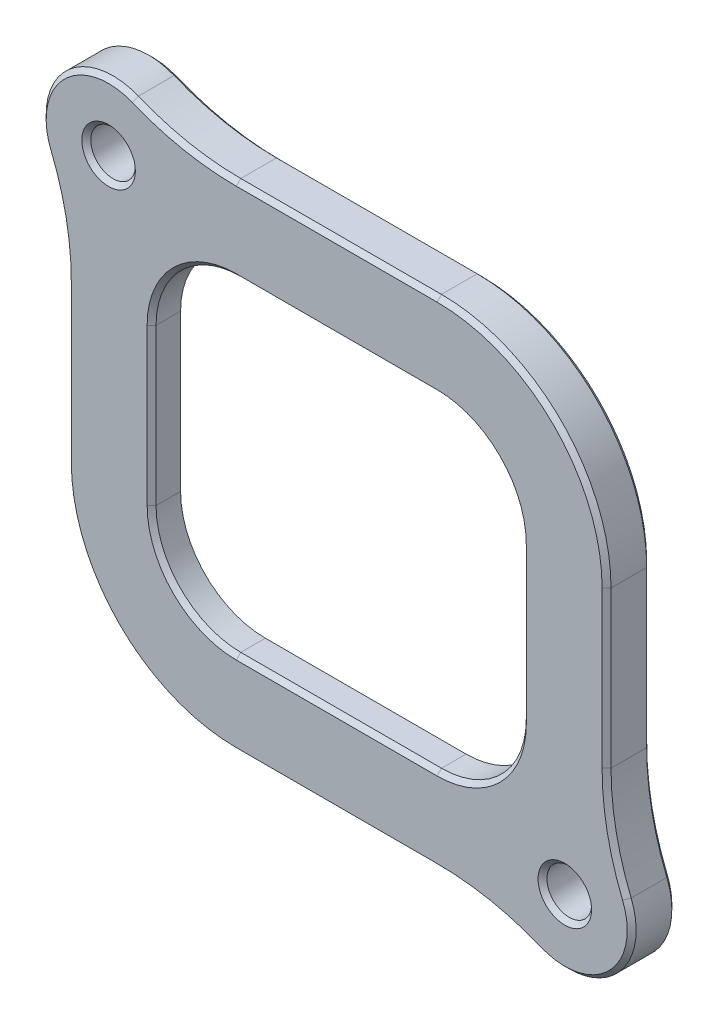
from build123d import *

# Parameters (mm, degrees)
AUFSATZ_LINEAR_AUSTRAGEN1_DEPTH    = 2
F_2_0_2_DURCHMESSER_BOHRUNG1_D     = 2
F_2_0_2_DURCHMESSER_BOHRUNG1_DEPTH = 2
F_2_0_2_DURCHMESSER_BOHRUNG1_TIP   = 0.600860619
SCHNITT_LINEAR_AUSTRAGEN1_DEPTH    = 0.7
FASE2_SIZE                         = 0.2


with BuildPart() as part:
    # Skizze1 → Aufsatz-Linear austragen1 (new body)
    with BuildSketch(Plane(origin=(0, 0, 0), x_dir=(0, 1, 0), z_dir=(0, 0, 1))):
        with BuildLine():
            Line((-3.5, 12.1), (3.5, 12.1))
            ThreePointArc((3.5, 12.1), (5.839273194, 12.328073296), (8.090437621, 13.0037028))
            ThreePointArc((8.090437621, 13.0037028), (11.348885271, 12.348885271), (12.0037028, 9.090437621))
            ThreePointArc((12.0037028, 9.090437621), (11.328073296, 6.839273194), (11.1, 4.5))
            Line((11.1, 4.5), (11.1, -4.5))
            ThreePointArc((11.1, -4.5), (8.874011537, -9.874011537), (3.5, -12.1))
            Line((3.5, -12.1), (-3.5, -12.1))
            ThreePointArc((-3.5, -12.1), (-5.839273194, -12.328073296), (-8.090437621, -13.0037028))
            ThreePointArc((-8.090437621, -13.0037028), (-11.348885271, -12.348885271), (-12.0037028, -9.090437621))
            ThreePointArc((-12.0037028, -9.090437621), (-11.328073296, -6.839273194), (-11.1, -4.5))
            Line((-11.1, -4.5), (-11.1, 4.5))
            ThreePointArc((-11.1, 4.5), (-8.874011537, 9.874011537), (-3.5, 12.1))
        make_face()
        with BuildLine():
            Line((-3.5, 8.3), (3.5, 8.3))
            ThreePointArc((3.5, 8.3), (6.187005769, 7.187005769), (7.3, 4.5))
            Line((7.3, 4.5), (7.3, -4.5))
            ThreePointArc((7.3, -4.5), (6.187005769, -7.187005769), (3.5, -8.3))
            Line((3.5, -8.3), (-3.5, -8.3))
            ThreePointArc((-3.5, -8.3), (-6.187005769, -7.187005769), (-7.3, -4.5))
            Line((-7.3, -4.5), (-7.3, 4.5))
            ThreePointArc((-7.3, 4.5), (-6.187005769, 7.187005769), (-3.5, 8.3))
        make_face(mode=Mode.SUBTRACT)
    extrude(amount=AUFSATZ_LINEAR_AUSTRAGEN1_DEPTH)

    # Ø2.0 (2) Durchmesser Bohrung1
    with Locations(Plane(origin=(0, 0, 2), x_dir=(0, -1, 0), z_dir=(0, 0, 1))):
        with Locations((-9.227564928, -10.227564928), (9.227564928, 10.227564928)):
            Hole(F_2_0_2_DURCHMESSER_BOHRUNG1_D / 2, depth=F_2_0_2_DURCHMESSER_BOHRUNG1_DEPTH)
            with Locations((0, 0, -(F_2_0_2_DURCHMESSER_BOHRUNG1_DEPTH + F_2_0_2_DURCHMESSER_BOHRUNG1_TIP / 2))):  # 118° drill point
                Cone(0, F_2_0_2_DURCHMESSER_BOHRUNG1_D / 2, F_2_0_2_DURCHMESSER_BOHRUNG1_TIP, mode=Mode.SUBTRACT)

    # Skizze5 → Schnitt-Linear austragen1 (cut)
    with BuildSketch(Plane(origin=(0, 0, 0), x_dir=(1, 0, 0), z_dir=(0, 0, -1))):
        with BuildLine():
            Line((4.5, -8.6), (-4.5, -8.6))
            ThreePointArc((-4.5, -8.6), (-8.106244584, -7.106244584), (-9.6, -3.5))
            Line((-9.6, -3.5), (-9.6, 3.5))
            ThreePointArc((-9.6, 3.5), (-8.106244584, 7.106244584), (-4.5, 8.6))
            Line((-4.5, 8.6), (4.5, 8.6))
            ThreePointArc((4.5, 8.6), (8.106244584, 7.106244584), (9.6, 3.5))
            Line((9.6, 3.5), (9.6, -3.5))
            ThreePointArc((9.6, -3.5), (8.106244584, -7.106244584), (4.5, -8.6))
        make_face()
    extrude(amount=-SCHNITT_LINEAR_AUSTRAGEN1_DEPTH, mode=Mode.SUBTRACT)

    # Fase2
    fase2_edges = [part.edges().sort_by_distance(p)[0] for p in [
        (0, 11.1, 2),
        (-8.3, 0, 2),
        (-7.187005769, 6.187005769, 2),
        (0, 7.3, 2),
        (0, 11.1, 0),
        (9.874011537, 8.874011537, 0),
        (12.1, 0, 0),
        (12.328073296, -5.839273194, 0),
        (12.348885271, -11.348885271, 0),
        (6.839273194, -11.328073296, 0),
        (0, -11.1, 0),
        (-9.874011537, -8.874011537, 0),
        (-12.1, 0, 0),
        (-12.328073296, 5.839273194, 0),
        (7.187005769, 6.187005769, 2),
        (-12.348885271, 11.348885271, 0),
        (-6.839273194, 11.328073296, 0),
        (8.3, 0, 2),
        (7.187005769, -6.187005769, 2),
        (0, -7.3, 2),
        (-6.839273194, 11.328073296, 2),
        (-12.348885271, 11.348885271, 2),
        (-12.328073296, 5.839273194, 2),
        (-12.1, 0, 2),
        (10.227564928, -10.227564928, 2),
        (10.227564928, -10.227564928, 0),
        (-9.874011537, -8.874011537, 2),
        (-7.187005769, -6.187005769, 2),
        (-10.227564928, 8.227564928, 2),
        (-10.227564928, 8.227564928, 0),
        (0, -11.1, 2),
        (6.839273194, -11.328073296, 2),
        (12.348885271, -11.348885271, 2),
        (12.328073296, -5.839273194, 2),
        (-8.106244584, 7.106244584, 0),
        (0, 8.6, 0),
        (8.106244584, 7.106244584, 0),
        (9.6, 0, 0),
        (8.106244584, -7.106244584, 0),
        (0, -8.6, 0),
        (-8.106244584, -7.106244584, 0),
        (12.1, 0, 2),
        (-9.6, 0, 0),
        (9.874011537, 8.874011537, 2),
    ]]
    chamfer(fase2_edges, length=FASE2_SIZE)


solid = part.part
